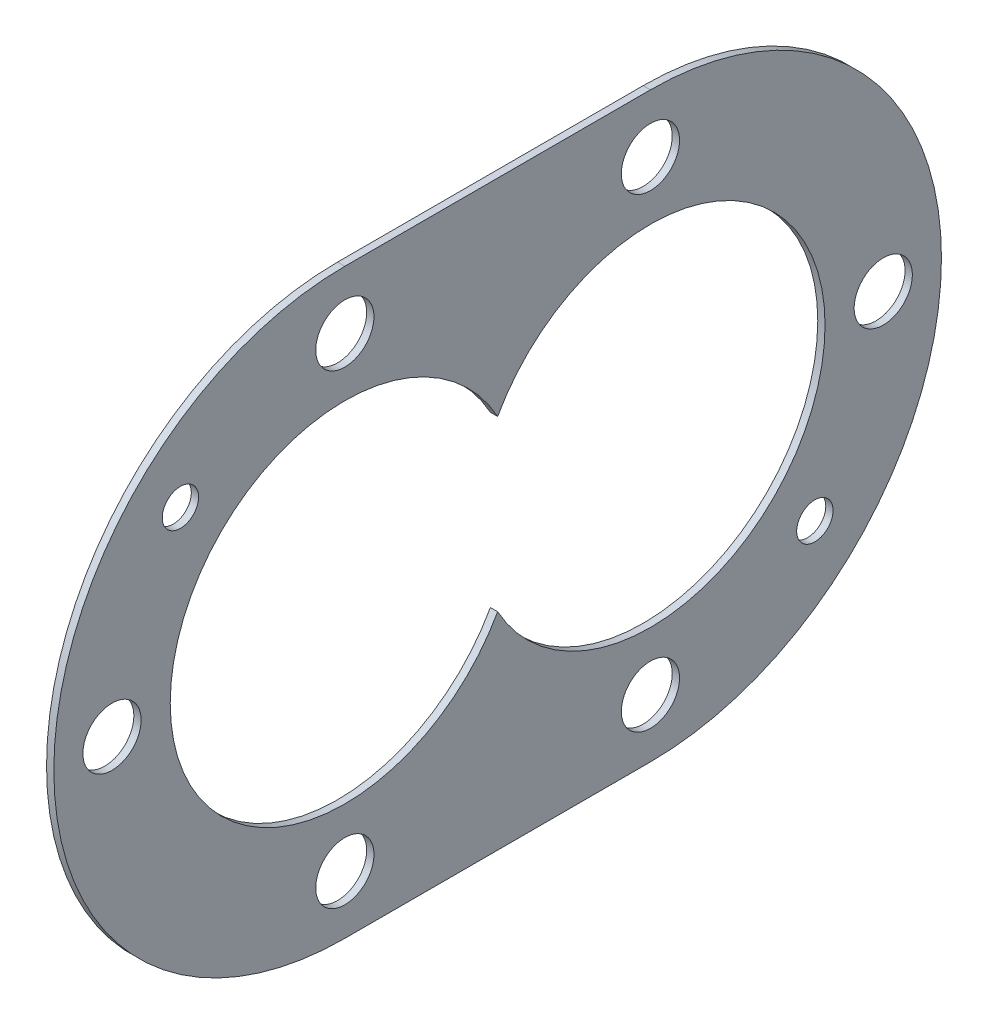
from build123d import *

# Parameters (mm, degrees)
F_01_GASKET_DEPTH  = 1
SKETCH_2_R         = 24
F_02_HOLE_UP_DEPTH = 3
SKETCH_3_R         = 24
F_03_HOLE_LO_DEPTH = 3
SKETCH_4_R         = 4
F_04_BOLT_0_DEPTH  = 3
SKETCH_5_R         = 4
F_04_BOLT_1_DEPTH  = 3
SKETCH_6_R         = 4
F_04_BOLT_2_DEPTH  = 3
SKETCH_7_R         = 4
F_04_BOLT_3_DEPTH  = 3
SKETCH_8_R         = 4
F_04_BOLT_4_DEPTH  = 3
SKETCH_9_R         = 4
F_04_BOLT_5_DEPTH  = 3
SKETCH_10_R        = 2.5
F_05_DOWEL_0_DEPTH = 3
SKETCH_11_R        = 2.5
F_05_DOWEL_1_DEPTH = 3


with BuildPart() as part:
    # 草图1 → 01_GASKET (new body)
    with BuildSketch(Plane(origin=(-31, 0, 0), x_dir=(0, 0, -1), z_dir=(1, 0, 0))):
        with BuildLine():
            Line((-104, -40), (-62, -40))
            ThreePointArc((-62, -40), (-22, 0), (-62, 40))
            Line((-62, 40), (-104, 40))
            ThreePointArc((-104, 40), (-144, 0), (-104, -40))
        make_face()
    extrude(amount=F_01_GASKET_DEPTH)

    # 草图2 → 02_HOLE_UP (cut)
    with BuildSketch(Plane(origin=(-32, 0, 0), x_dir=(0, 0, -1), z_dir=(1, 0, 0))):
        with Locations((-104, 0)):
            Circle(SKETCH_2_R)
    extrude(amount=F_02_HOLE_UP_DEPTH, mode=Mode.SUBTRACT)

    # 草图3 → 03_HOLE_LO (cut)
    with BuildSketch(Plane(origin=(-32, 0, 0), x_dir=(0, 0, -1), z_dir=(1, 0, 0))):
        with Locations((-62, 0)):
            Circle(SKETCH_3_R)
    extrude(amount=F_03_HOLE_LO_DEPTH, mode=Mode.SUBTRACT)

    # 草图4 → 04_BOLT_0 (cut)
    with BuildSketch(Plane(origin=(-32, 0, 0), x_dir=(0, 0, -1), z_dir=(1, 0, 0))):
        with Locations((-104, 32)):
            Circle(SKETCH_4_R)
    extrude(amount=F_04_BOLT_0_DEPTH, mode=Mode.SUBTRACT)

    # 草图5 → 04_BOLT_1 (cut)
    with BuildSketch(Plane(origin=(-32, 0, 0), x_dir=(0, 0, -1), z_dir=(1, 0, 0))):
        with Locations((-104, -32)):
            Circle(SKETCH_5_R)
    extrude(amount=F_04_BOLT_1_DEPTH, mode=Mode.SUBTRACT)

    # 草图6 → 04_BOLT_2 (cut)
    with BuildSketch(Plane(origin=(-32, 0, 0), x_dir=(0, 0, -1), z_dir=(1, 0, 0))):
        with Locations((-62, 32)):
            Circle(SKETCH_6_R)
    extrude(amount=F_04_BOLT_2_DEPTH, mode=Mode.SUBTRACT)

    # 草图7 → 04_BOLT_3 (cut)
    with BuildSketch(Plane(origin=(-32, 0, 0), x_dir=(0, 0, -1), z_dir=(1, 0, 0))):
        with Locations((-62, -32)):
            Circle(SKETCH_7_R)
    extrude(amount=F_04_BOLT_3_DEPTH, mode=Mode.SUBTRACT)

    # 草图8 → 04_BOLT_4 (cut)
    with BuildSketch(Plane(origin=(-32, 0, 0), x_dir=(0, 0, -1), z_dir=(1, 0, 0))):
        with Locations((-136, 0)):
            Circle(SKETCH_8_R)
    extrude(amount=F_04_BOLT_4_DEPTH, mode=Mode.SUBTRACT)

    # 草图9 → 04_BOLT_5 (cut)
    with BuildSketch(Plane(origin=(-32, 0, 0), x_dir=(0, 0, -1), z_dir=(1, 0, 0))):
        with Locations((-30, 0)):
            Circle(SKETCH_9_R)
    extrude(amount=F_04_BOLT_5_DEPTH, mode=Mode.SUBTRACT)

    # 草图10 → 05_DOWEL_0 (cut)
    with BuildSketch(Plane(origin=(-32, 0, 0), x_dir=(0, 0, -1), z_dir=(1, 0, 0))):
        with Locations((-126.6, 22.6)):
            Circle(SKETCH_10_R)
    extrude(amount=F_05_DOWEL_0_DEPTH, mode=Mode.SUBTRACT)

    # 草图11 → 05_DOWEL_1 (cut)
    with BuildSketch(Plane(origin=(-32, 0, 0), x_dir=(0, 0, -1), z_dir=(1, 0, 0))):
        with Locations((-39.4, -22.6)):
            Circle(SKETCH_11_R)
    extrude(amount=F_05_DOWEL_1_DEPTH, mode=Mode.SUBTRACT)


solid = part.part
